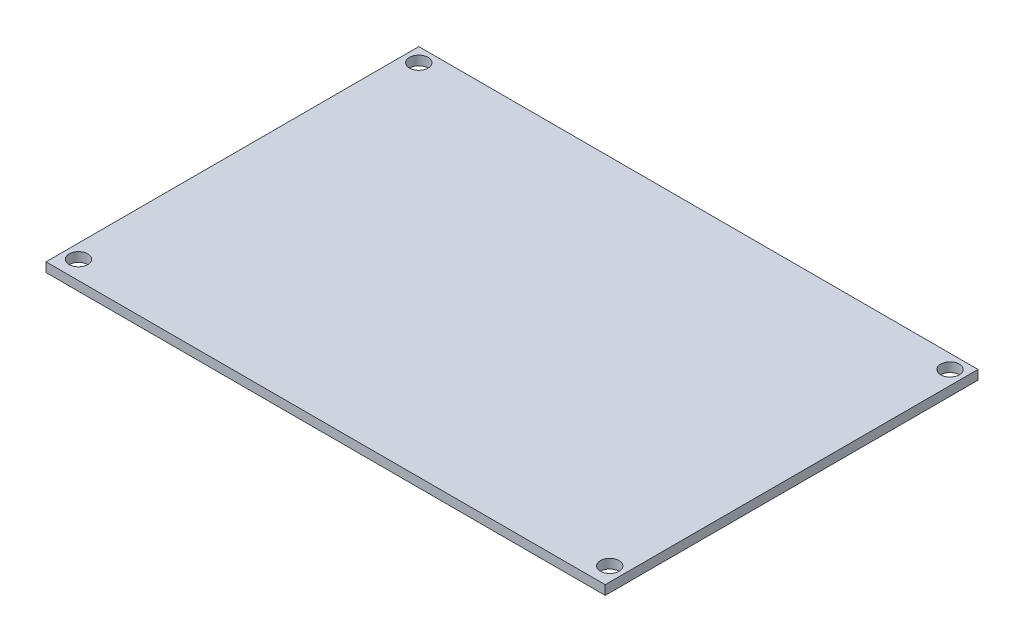
from build123d import *

# Parameters (mm, degrees)
SKETCH1_W               = 120
SKETCH1_H               = 80
BOSS_EXTRUDE1_DEPTH     = 2
CUT_EXTRUDE1_DEPTH      = 10
CUT_EXTRUDE1_DEPTH_BACK = 10
SKETCH2_R               = 2


with BuildPart() as part:
    # Sketch1 → Boss-Extrude1 (new body)
    with BuildSketch(Plane(origin=(0, 0, 0), x_dir=(1, 0, 0), z_dir=(0, 1, 0))):
        Rectangle(SKETCH1_W, SKETCH1_H)
    extrude(amount=BOSS_EXTRUDE1_DEPTH)

    # Sketch2 → Cut-Extrude1 (cut, two sides: drawn at the far end of the back side and taken through both)
    with BuildSketch(Plane(origin=(0, 2, 0), x_dir=(1, 0, 0), z_dir=(0, 1, 0)).offset(-CUT_EXTRUDE1_DEPTH_BACK)):
        with Locations((-57, 37)):
            Circle(SKETCH2_R)
        with Locations((57, 37)):
            Circle(SKETCH2_R)
        with Locations((57, -36.028768063)):
            Circle(SKETCH2_R)
        with Locations((-57, -36.028768063)):
            Circle(SKETCH2_R)
    extrude(amount=CUT_EXTRUDE1_DEPTH + CUT_EXTRUDE1_DEPTH_BACK, mode=Mode.SUBTRACT)


solid = part.part
